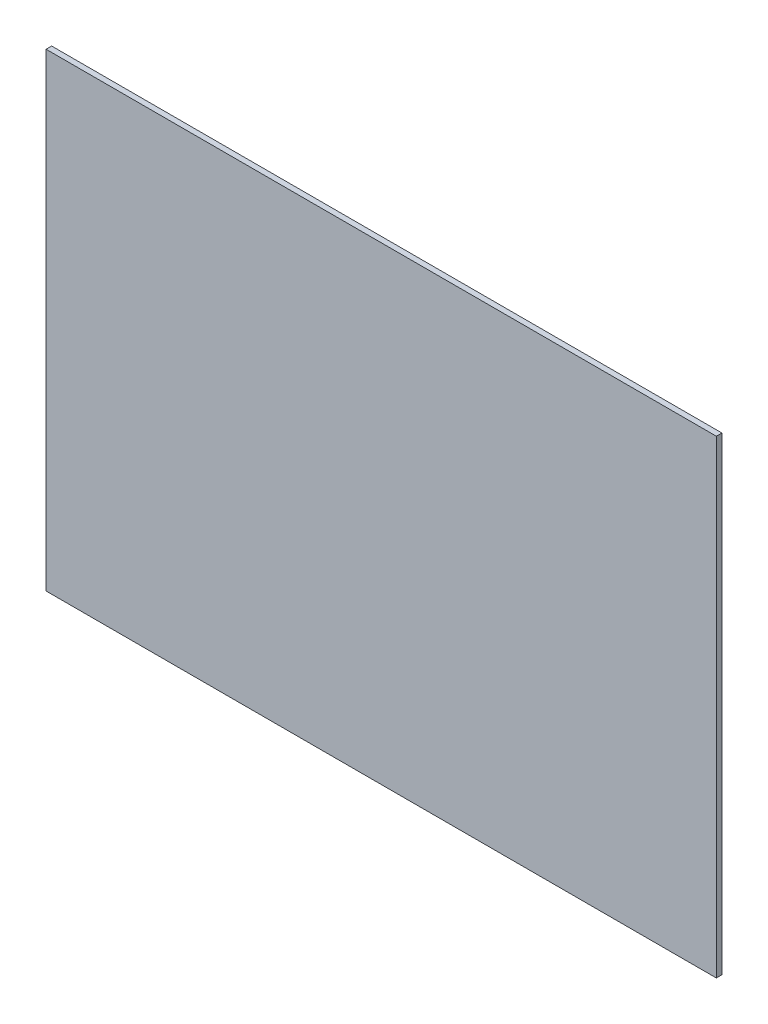
from build123d import *

# Parameters (mm, degrees)
SKETCH1_W           = 190.5
SKETCH1_H           = 133.35
BOSS_EXTRUDE1_DEPTH = 1.5875


with BuildPart() as part:
    # Sketch1 → Boss-Extrude1 (new body)
    with BuildSketch(Plane.XY):
        with Locations((95.25, 66.675)):
            Rectangle(SKETCH1_W, SKETCH1_H)
    extrude(amount=BOSS_EXTRUDE1_DEPTH)


solid = part.part
